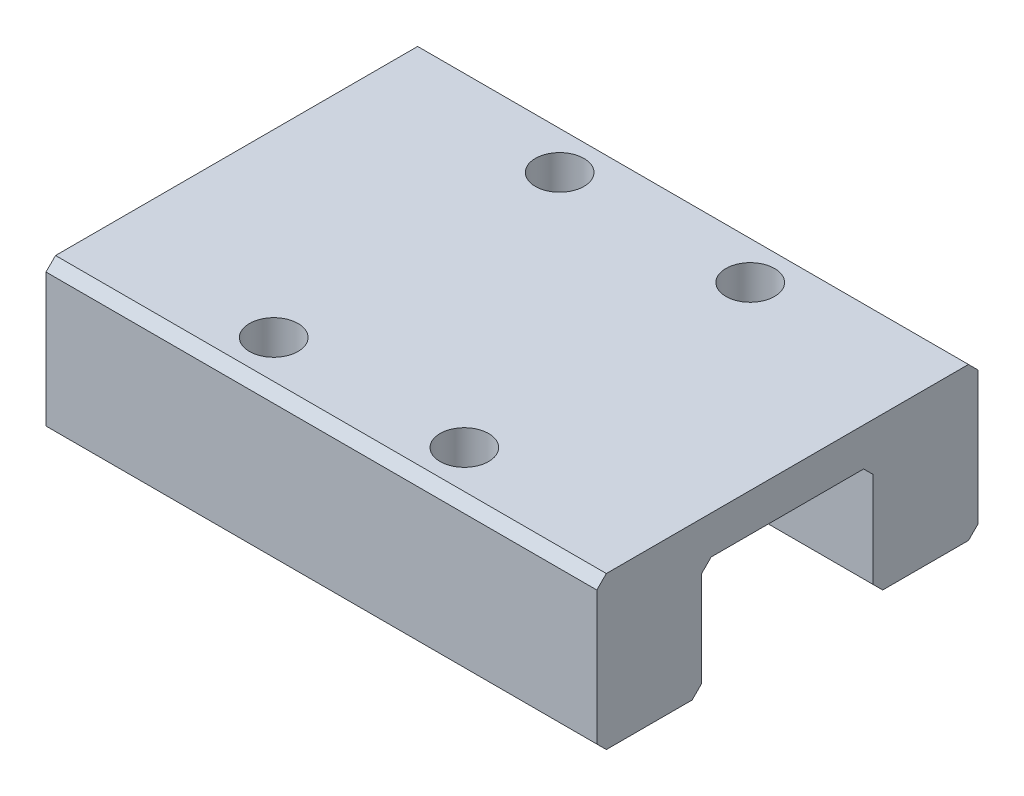
from build123d import *

# Parameters (mm, degrees)
EXTRUDE_1_DEPTH     = 28.9
CHAMFER_1_SIZE      = 0.5
SKETCH_3_R          = 1.275
CUT_EXTRUDE_2_DEPTH = 3


with BuildPart() as part:
    # 草图2 → 拉伸1 (new body)
    with BuildSketch(Plane(origin=(0, 0, 0), x_dir=(0, 0, -1), z_dir=(1, 0, 0))):
        Polygon((-4.5, 0), (4.5, 0), (4.5, -6), (10, -6), (10, 2), (-10, 2), (-10, -6), (-4.5, -6), align=None)
    extrude(amount=EXTRUDE_1_DEPTH)

    # 倒角1
    chamfer_1_edges = [part.edges().sort_by_distance(p)[0] for p in [
        (14.45, -6, 10),
        (14.45, 2, 10),
        (14.45, 2, -10),
        (14.45, -6, -10),
        (14.45, -6, -4.5),
        (14.45, 0, -4.5),
        (14.45, 0, 4.5),
        (14.45, -6, 4.5),
    ]]
    chamfer(chamfer_1_edges, length=CHAMFER_1_SIZE)

    # 草图3 → 拉伸2 (cut)
    with BuildSketch(Plane(origin=(0, 2, 0), x_dir=(1, 0, 0), z_dir=(0, 1, 0))):
        with Locations(Location((9.45, 7.5, 0), (0, 0, 270))):
            Circle(SKETCH_3_R)
        with Locations(Location((19.45, 7.5, 0), (0, 0, 90))):
            Circle(SKETCH_3_R)
        with Locations(Location((19.45, -7.5, 0), (0, 0, 270))):
            Circle(SKETCH_3_R)
        with Locations(Location((9.45, -7.5, 0), (0, 0, 90))):
            Circle(SKETCH_3_R)
    extrude(amount=-CUT_EXTRUDE_2_DEPTH, mode=Mode.SUBTRACT)


solid = part.part
